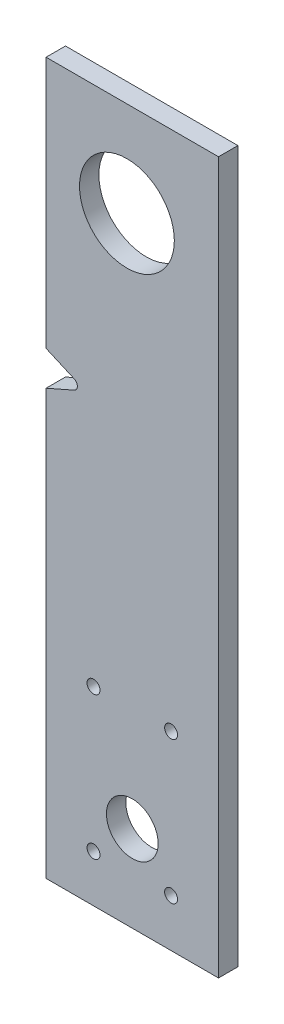
from build123d import *

# Parameters (mm, degrees)
SKETCH1_W           = 42.5
SKETCH1_H           = 40
BOSS_EXTRUDE1_DEPTH = 2.25
SKETCH3_R           = 6
CUT_EXTRUDE2_DEPTH  = 5
SKETCH4_W           = 42.5
SKETCH4_H           = 4.5
BOSS_EXTRUDE2_DEPTH = 15
SKETCH7_R           = 1.5
CUT_EXTRUDE3_DEPTH  = 10
SKETCH8_W           = 2.5
SKETCH8_H           = 55
CUT_EXTRUDE4_DEPTH  = 10
SKETCH9_W           = 40
SKETCH9_H           = 4.5
BOSS_EXTRUDE3_DEPTH = 110
SKETCH11_R          = 11
CUT_EXTRUDE5_DEPTH  = 100
CUT_EXTRUDE6_DEPTH  = 100


with BuildPart() as part:
    # Sketch1 → Boss-Extrude1 (new, symmetric)
    with BuildSketch(Plane.XY):
        Rectangle(SKETCH1_W, SKETCH1_H)
    extrude(amount=BOSS_EXTRUDE1_DEPTH, both=True)

    # Sketch3 → Cut-Extrude2 (cut, symmetric)
    with BuildSketch(Plane.XY.offset(2.25)):
        with Locations((1.25, 0)):
            Circle(SKETCH3_R)
    extrude(amount=CUT_EXTRUDE2_DEPTH, both=True, mode=Mode.SUBTRACT)

    # Sketch4 → Boss-Extrude2 (add)
    with BuildSketch(Plane(origin=(0, 20, 0), x_dir=(1, 0, 0), z_dir=(0, 1, 0))):
        Rectangle(SKETCH4_W, SKETCH4_H)
    extrude(amount=BOSS_EXTRUDE2_DEPTH)

    # Sketch7 → Cut-Extrude3 (cut)
    with BuildSketch(Plane.XY.offset(2.25)):
        with Locations((-7.75, 24.053632735)):
            Circle(SKETCH7_R)
        with Locations((10.25, 24.053632735)):
            Circle(SKETCH7_R)
        with Locations((10.25, -8.945771811)):
            Circle(SKETCH7_R)
        with Locations((-7.75, -9.053903396)):
            Circle(SKETCH7_R)
    extrude(amount=-CUT_EXTRUDE3_DEPTH, mode=Mode.SUBTRACT)

    # Sketch8 → Cut-Extrude4 (cut)
    with BuildSketch(Plane.XY.offset(2.25)):
        with Locations((-20, 7.5)):
            Rectangle(SKETCH8_W, SKETCH8_H)
    extrude(amount=-CUT_EXTRUDE4_DEPTH, mode=Mode.SUBTRACT)

    # Sketch9 → Boss-Extrude3 (add)
    with BuildSketch(Plane(origin=(0, 35, 0), x_dir=(1, 0, 0), z_dir=(0, 1, 0))):
        with Locations((1.25, 0)):
            Rectangle(SKETCH9_W, SKETCH9_H)
    extrude(amount=BOSS_EXTRUDE3_DEPTH)

    # Sketch11 → Cut-Extrude5 (cut)
    with BuildSketch(Plane(origin=(0, 0, -2.25), x_dir=(-1, 0, 0), z_dir=(0, 0, -1))):
        with Locations((0, 123)):
            Circle(SKETCH11_R)
    extrude(amount=-CUT_EXTRUDE5_DEPTH, mode=Mode.SUBTRACT)

    # Sketch12 → Cut-Extrude6 (cut)
    with BuildSketch(Plane(origin=(0, 0, -2.25), x_dir=(-1, 0, 0), z_dir=(0, 0, -1))):
        with BuildLine():
            Line((18.75, 78.5), (18.75, 86.5))
            Line((18.75, 86.5), (12.247409999, 83.644510066))
            ThreePointArc((12.247409999, 83.644510066), (11.5, 82.499999945), (12.2474101, 81.35548989))
            Line((12.2474101, 81.35548989), (18.75, 78.5))
        make_face()
    extrude(amount=-CUT_EXTRUDE6_DEPTH, mode=Mode.SUBTRACT)


solid = part.part
